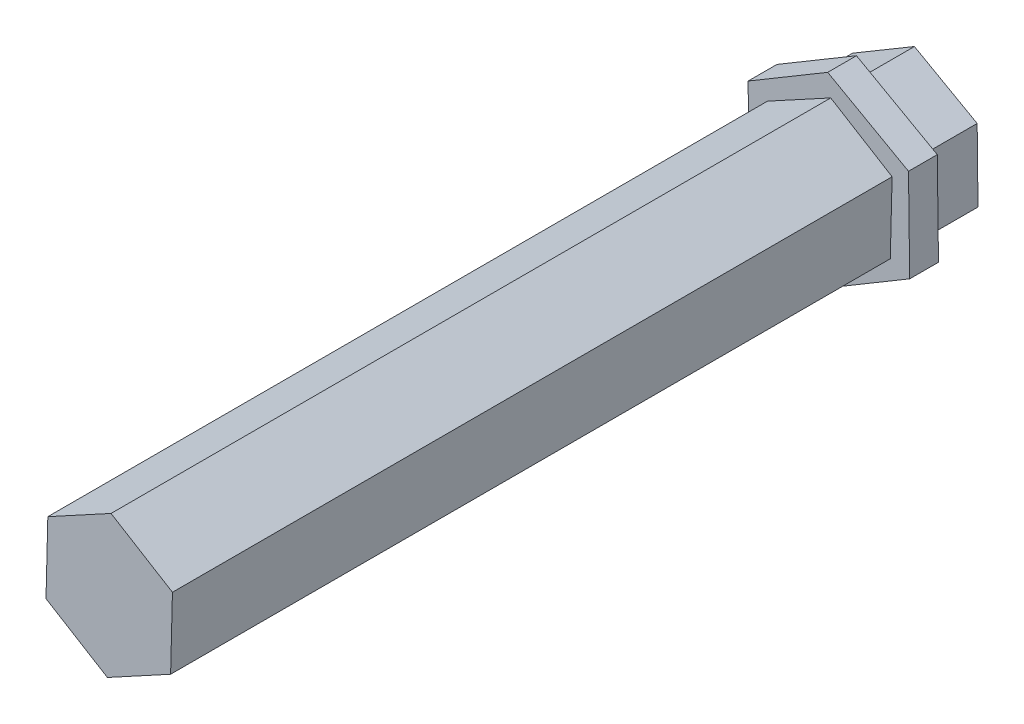
from build123d import *

# Parameters (mm, degrees)
BOSS_EXTRUDE1_DEPTH = 25
BOSS_EXTRUDE2_DEPTH = 1
BOSS_EXTRUDE3_DEPTH = 3


with BuildPart() as part:
    # Sketch2 → Boss-Extrude1 (new body)
    with BuildSketch(Plane.XY):
        Polygon((2.132692592, -1.304462459), (2.196043924, 1.194734734), (0.063351332, 2.499197193), (-2.132692592, 1.304462459), (-2.196043924, -1.194734734), (-0.063351332, -2.499197193), align=None)
    extrude(amount=BOSS_EXTRUDE1_DEPTH)

    # Sketch3 → Boss-Extrude2 (add)
    with BuildSketch(Plane.XY):
        Polygon((2.806699615, -1.572449101), (2.765130676, 1.644448617), (-0.04156894, 3.216897718), (-2.806699615, 1.572449101), (-2.765130676, -1.644448617), (0.04156894, -3.216897718), align=None)
    extrude(amount=-BOSS_EXTRUDE2_DEPTH)

    # Sketch4 → Boss-Extrude3 (add)
    with BuildSketch(Plane.XY):
        Polygon((-2.150386975, -1.275082687), (0.029060512, -2.499831092), (2.179447487, -1.224748404), (2.150386975, 1.275082687), (-0.029060512, 2.499831092), (-2.179447487, 1.224748404), align=None)
    extrude(amount=-BOSS_EXTRUDE3_DEPTH)


solid = part.part
